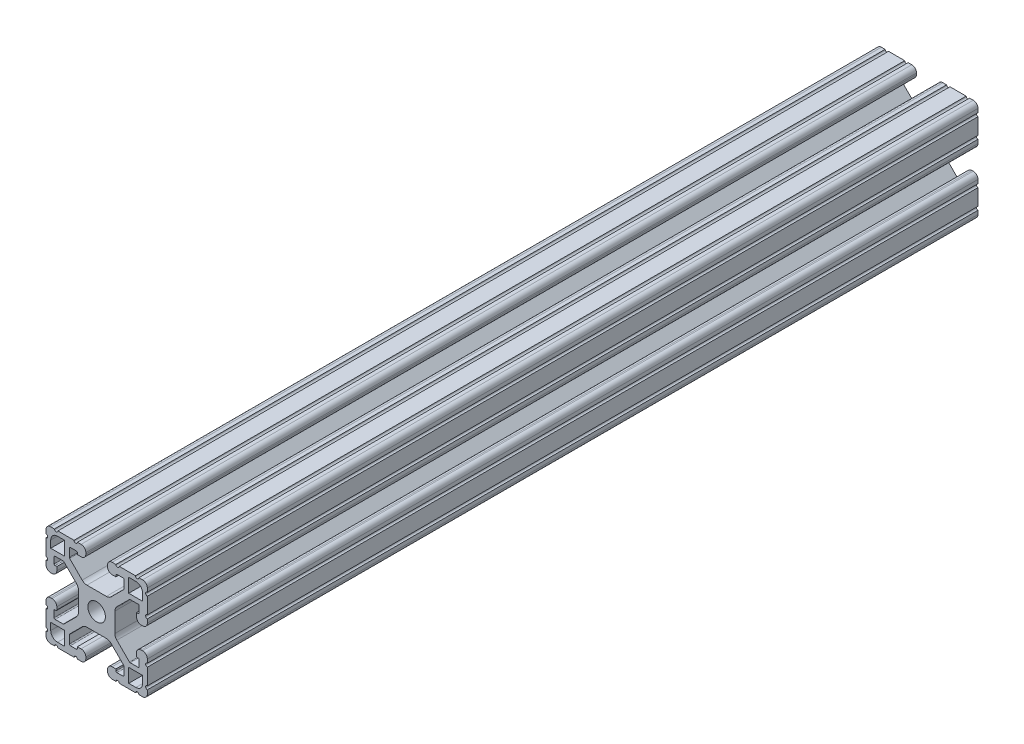
from build123d import *

# Parameters (mm, degrees)
BOSS_EXTRUDE1_DEPTH      = 156.21
BOSS_EXTRUDE1_DEPTH_BACK = 156.21
SKETCH3_W                = 38.1
SKETCH3_H                = 38.1
SKETCH4_W                = 5.207
SKETCH4_H                = 5.207
SKETCH4_R                = 3.302
CUT_EXTRUDE1_DEPTH       = 314.579433956
CUT_EXTRUDE2_DEPTH       = 314.579433956
FILLET1_R                = 2.54
FILLET2_R                = 1.778
FILLET3_R                = 0.396875


with BuildPart() as part:
    # Sketch3 → Boss-Extrude1 (new, two sides: drawn at the far end of the back side and taken through both)
    with BuildSketch(Plane.XY.offset(-BOSS_EXTRUDE1_DEPTH_BACK)):
        Rectangle(SKETCH3_W, SKETCH3_H)
    extrude(amount=BOSS_EXTRUDE1_DEPTH + BOSS_EXTRUDE1_DEPTH_BACK)

    # Sketch4 → Cut-Extrude1 (cut, through all)
    with BuildSketch(Plane.XY.offset(156.21)):
        Polygon((7.239, 14.986), (4.064, 14.986), (4.064, 19.05), (-4.064, 19.05), (-4.064, 14.986), (-7.239, 14.986), (-7.239, 16.002), (-10.287, 16.002), (-10.287, 12.442261469), (-4.702738531, 6.858), (4.702738531, 6.858), (10.287, 12.442261469), (10.287, 16.002), (7.239, 16.002), align=None)
        Polygon((10.287, -12.442261469), (4.702738531, -6.858), (-4.702738531, -6.858), (-10.287, -12.442261469), (-10.287, -16.002), (-7.239, -16.002), (-7.239, -14.986), (-4.064, -14.986), (-4.064, -19.05), (4.064, -19.05), (4.064, -14.986), (7.239, -14.986), (7.239, -16.002), (10.287, -16.002), align=None)
        Polygon((-12.442261469, -10.287), (-6.858, -4.702738531), (-6.858, 4.702738531), (-12.442261469, 10.287), (-16.002, 10.287), (-16.002, 7.239), (-14.986, 7.239), (-14.986, 4.064), (-19.05, 4.064), (-19.05, -4.064), (-14.986, -4.064), (-14.986, -7.239), (-16.002, -7.239), (-16.002, -10.287), align=None)
        Polygon((14.986, -7.239), (14.986, -4.064), (19.05, -4.064), (19.05, 4.064), (14.986, 4.064), (14.986, 7.239), (16.002, 7.239), (16.002, 10.287), (12.442261469, 10.287), (6.858, 4.702738531), (6.858, -4.702738531), (12.442261469, -10.287), (16.002, -10.287), (16.002, -7.239), align=None)
        with Locations((14.6685, 14.6685)):
            Rectangle(SKETCH4_W, SKETCH4_H)
        with Locations((14.6685, -14.6685)):
            Rectangle(SKETCH4_W, SKETCH4_H)
        with Locations((-14.6685, 14.6685)):
            Rectangle(SKETCH4_W, SKETCH4_H)
        with Locations((-14.6685, -14.6685)):
            Rectangle(SKETCH4_W, SKETCH4_H)
        Circle(SKETCH4_R)
    extrude(amount=-CUT_EXTRUDE1_DEPTH, mode=Mode.SUBTRACT)

    # Sketch5 → Cut-Extrude2 (cut, through all)
    with BuildSketch(Plane.XY.offset(156.21)):
        with BuildLine():
            Line((-14.605, 19.05), (-15.875, 19.05))
            ThreePointArc((-15.875, 19.05), (-15.24, 18.415), (-14.605, 19.05))
        make_face()
        with BuildLine():
            Line((-7.239, 19.05), (-8.509, 19.05))
            ThreePointArc((-8.509, 19.05), (-7.874, 18.415), (-7.239, 19.05))
        make_face()
        with BuildLine():
            ThreePointArc((-19.05, 14.605), (-18.415, 15.24), (-19.05, 15.875))
            Line((-19.05, 15.875), (-19.05, 14.605))
        make_face()
        with BuildLine():
            ThreePointArc((-19.05, 7.239), (-18.415, 7.874), (-19.05, 8.509))
            Line((-19.05, 8.509), (-19.05, 7.239))
        make_face()
        with BuildLine():
            ThreePointArc((7.239, 19.05), (7.874, 18.415), (8.509, 19.05))
            Line((8.509, 19.05), (7.239, 19.05))
        make_face()
        with BuildLine():
            ThreePointArc((14.605, 19.05), (15.24, 18.415), (15.875, 19.05))
            Line((15.875, 19.05), (14.605, 19.05))
        make_face()
        with BuildLine():
            Line((19.05, 14.605), (19.05, 15.875))
            ThreePointArc((19.05, 15.875), (18.415, 15.24), (19.05, 14.605))
        make_face()
        with BuildLine():
            Line((19.05, 7.239), (19.05, 8.509))
            ThreePointArc((19.05, 8.509), (18.415, 7.874), (19.05, 7.239))
        make_face()
        with BuildLine():
            ThreePointArc((19.05, -7.239), (18.415, -7.874), (19.05, -8.509))
            Line((19.05, -8.509), (19.05, -7.239))
        make_face()
        with BuildLine():
            ThreePointArc((19.05, -14.605), (18.415, -15.24), (19.05, -15.875))
            Line((19.05, -15.875), (19.05, -14.605))
        make_face()
        with BuildLine():
            Line((14.605, -19.05), (15.875, -19.05))
            ThreePointArc((15.875, -19.05), (15.24, -18.415), (14.605, -19.05))
        make_face()
        with BuildLine():
            Line((7.239, -19.05), (8.509, -19.05))
            ThreePointArc((8.509, -19.05), (7.874, -18.415), (7.239, -19.05))
        make_face()
        with BuildLine():
            ThreePointArc((-7.239, -19.05), (-7.874, -18.415), (-8.509, -19.05))
            Line((-8.509, -19.05), (-7.239, -19.05))
        make_face()
        with BuildLine():
            ThreePointArc((-14.605, -19.05), (-15.24, -18.415), (-15.875, -19.05))
            Line((-15.875, -19.05), (-14.605, -19.05))
        make_face()
        with BuildLine():
            Line((-19.05, -14.605), (-19.05, -15.875))
            ThreePointArc((-19.05, -15.875), (-18.415, -15.24), (-19.05, -14.605))
        make_face()
        with BuildLine():
            Line((-19.05, -7.239), (-19.05, -8.509))
            ThreePointArc((-19.05, -8.509), (-18.415, -7.874), (-19.05, -7.239))
        make_face()
    extrude(amount=-CUT_EXTRUDE2_DEPTH, mode=Mode.SUBTRACT)

    # Fillet1
    fillet1_edges = [part.edges().sort_by_distance(p)[0] for p in [
        (6.858, -4.702738531, 0),
        (6.858, 4.702738531, 0),
        (-17.272, 17.272, 0),
        (-17.272, -17.272, 0),
        (17.272, -17.272, 0),
        (17.272, 17.272, 0),
        (-4.702738531, -6.858, 0),
        (4.702738531, -6.858, 0),
        (-6.858, 4.702738531, 0),
        (-6.858, -4.702738531, 0),
        (4.702738531, 6.858, 0),
        (-4.702738531, 6.858, 0),
    ]]
    fillet(fillet1_edges, radius=FILLET1_R)

    # Fillet2
    fillet2_edges = [part.edges().sort_by_distance(p)[0] for p in [
        (14.986, 4.064, 0),
        (19.05, 4.064, 0),
        (19.05, -4.064, 0),
        (14.986, -4.064, 0),
        (4.064, -14.986, 0),
        (4.064, -19.05, 0),
        (-4.064, -19.05, 0),
        (-4.064, -14.986, 0),
        (-14.986, -4.064, 0),
        (-19.05, -4.064, 0),
        (-19.05, 4.064, 0),
        (-14.986, 4.064, 0),
        (-19.05, 19.05, 0),
        (19.05, 19.05, 0),
        (19.05, -19.05, 0),
        (-19.05, -19.05, 0),
        (-4.064, 14.986, 0),
        (-4.064, 19.05, 0),
        (4.064, 19.05, 0),
        (4.064, 14.986, 0),
    ]]
    fillet(fillet2_edges, radius=FILLET2_R)

    # Fillet3
    fillet3_edges = [part.edges().sort_by_distance(p)[0] for p in [
        (12.442261469, 10.287, 0),
        (16.002, 10.287, 0),
        (16.002, 7.239, 0),
        (16.002, -7.239, 0),
        (16.002, -10.287, 0),
        (12.442261469, -10.287, 0),
        (-7.239, -16.002, 0),
        (-10.287, -16.002, 0),
        (-10.287, -12.442261469, 0),
        (10.287, -12.442261469, 0),
        (10.287, -16.002, 0),
        (7.239, -16.002, 0),
        (-16.002, 7.239, 0),
        (-16.002, 10.287, 0),
        (-12.442261469, 10.287, 0),
        (-12.442261469, -10.287, 0),
        (-16.002, -10.287, 0),
        (-14.986, -7.239, 0),
        (-10.287, 12.442261469, 0),
        (-10.287, 16.002, 0),
        (-7.239, 16.002, 0),
        (7.239, 16.002, 0),
        (10.287, 16.002, 0),
        (10.287, 12.442261469, 0),
    ]]
    fillet(fillet3_edges, radius=FILLET3_R)


solid = part.part
